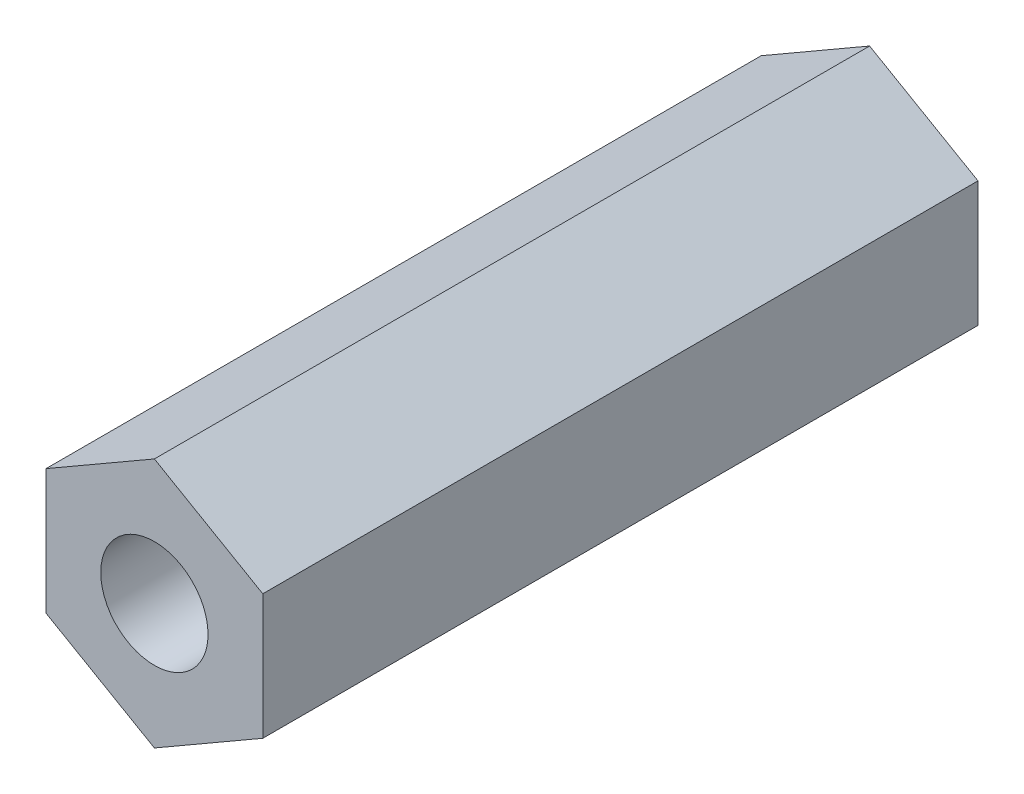
from build123d import *

# Parameters (mm, degrees)
BOSS_EXTRUDE1_DEPTH = 20
SKETCH3_R           = 1.5
CUT_EXTRUDE1_DEPTH  = 20


with BuildPart() as part:
    # Sketch2 → Boss-Extrude1 (new body)
    with BuildSketch(Plane.XY):
        Polygon((0, -3.5), (3.031088913, -1.75), (3.031088913, 1.75), (0, 3.5), (-3.031088913, 1.75), (-3.031088913, -1.75), align=None)
    extrude(amount=BOSS_EXTRUDE1_DEPTH)

    # Sketch3 → Cut-Extrude1 (cut)
    with BuildSketch(Plane(origin=(0, 0, 0), x_dir=(-1, 0, 0), z_dir=(0, 0, -1))):
        Circle(SKETCH3_R)
    extrude(amount=-CUT_EXTRUDE1_DEPTH, mode=Mode.SUBTRACT)


solid = part.part
